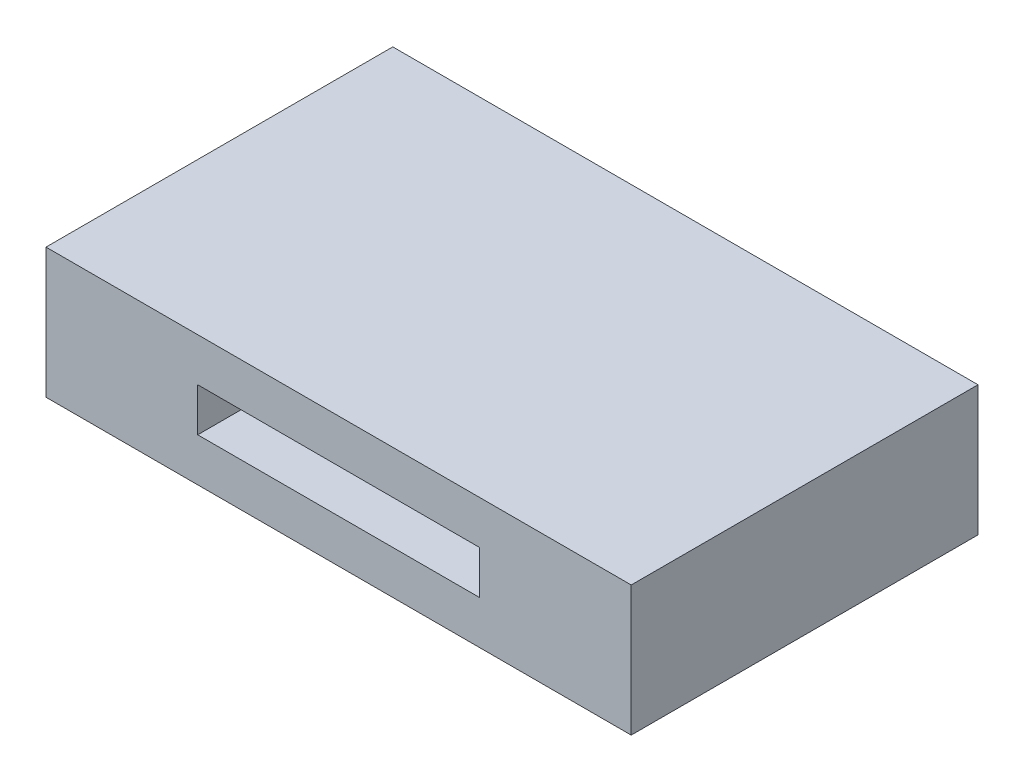
from build123d import *

# Parameters (mm, degrees)
SKETCH1_W           = 27
SKETCH1_H           = 6
SKETCH1_W_2         = 13
SKETCH1_H_2         = 2
BOSS_EXTRUDE1_DEPTH = 16


with BuildPart() as part:
    # Sketch1 → Boss-Extrude1 (new body)
    with BuildSketch(Plane.XY):
        Rectangle(SKETCH1_W, SKETCH1_H)
        Rectangle(SKETCH1_W_2, SKETCH1_H_2, mode=Mode.SUBTRACT)
    extrude(amount=BOSS_EXTRUDE1_DEPTH)


solid = part.part
